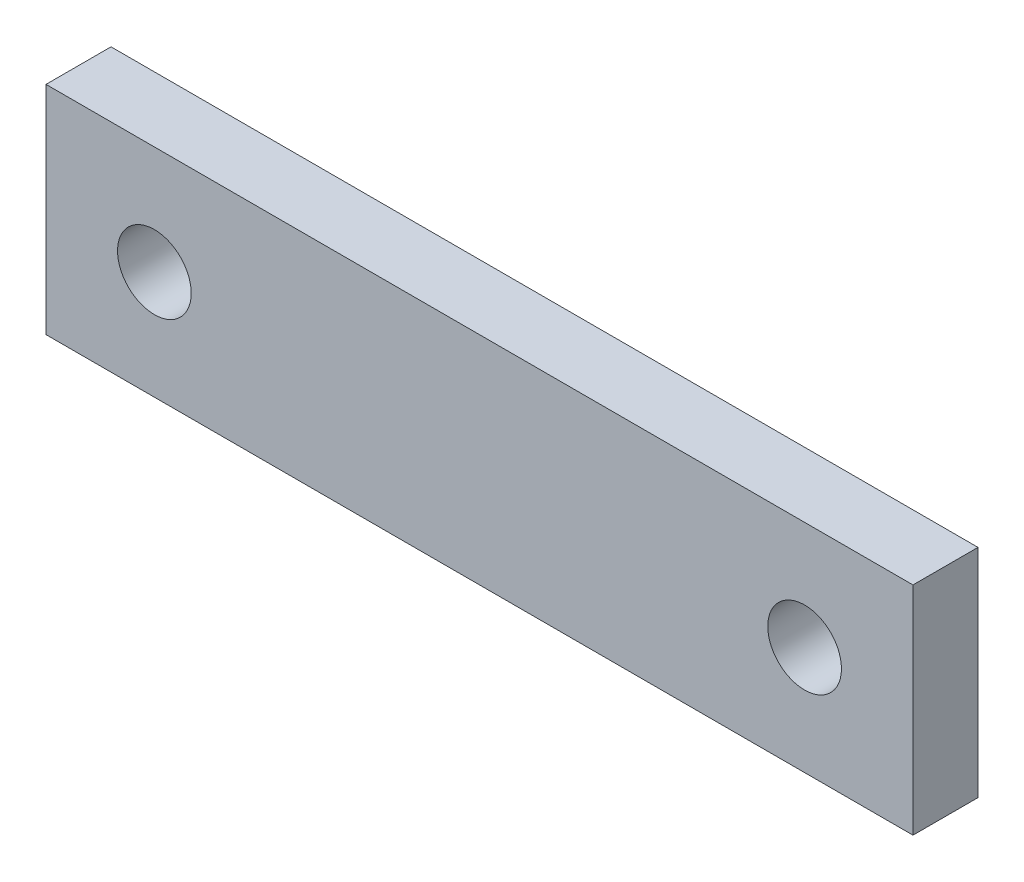
from build123d import *

# Parameters (mm, degrees)
MAIN_PROFILE_SKETCH_W = 40
MAIN_PROFILE_SKETCH_H = 10
MAIN_PROFILE_SKETCH_R = 1.7
MAIN_EXTRUSION_DEPTH  = 3


with BuildPart() as part:
    # Main Profile Sketch → Main Extrusion (new body)
    with BuildSketch(Plane.XY.offset(44.5)):
        with Locations((-110, -36.5)):
            Rectangle(MAIN_PROFILE_SKETCH_W, MAIN_PROFILE_SKETCH_H)
        with Locations((-125, -36.5)):
            Circle(MAIN_PROFILE_SKETCH_R, mode=Mode.SUBTRACT)
        with Locations((-95, -36.5)):
            Circle(MAIN_PROFILE_SKETCH_R, mode=Mode.SUBTRACT)
    extrude(amount=-MAIN_EXTRUSION_DEPTH)


solid = part.part
